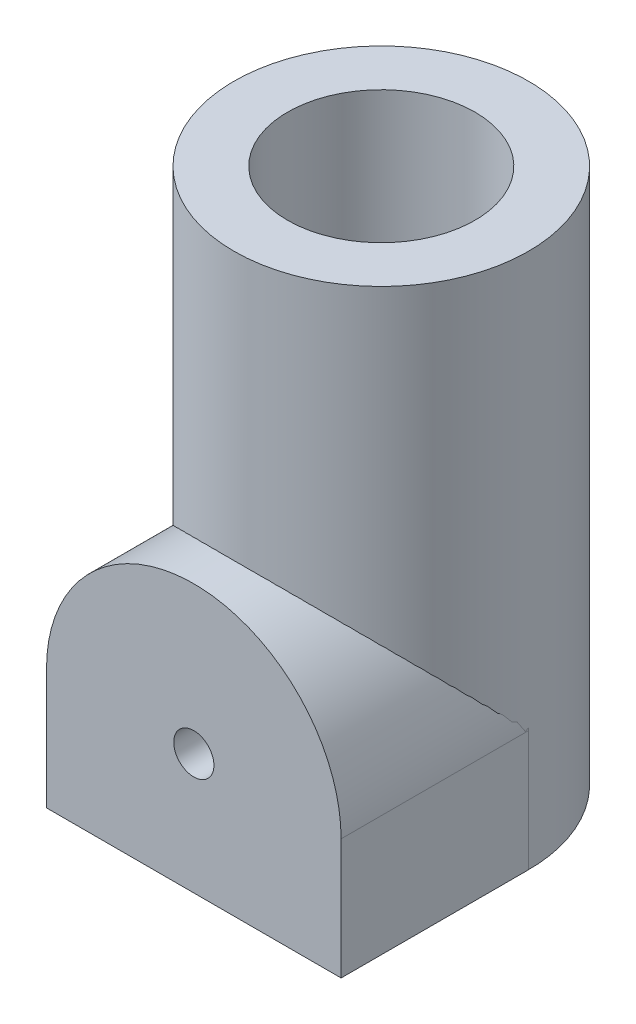
from build123d import *

# Parameters (mm, degrees)
SKETCH1_R           = 5.5
SKETCH1_R_2         = 3.5
BOSS_EXTRUDE1_DEPTH = 20
BOSS_EXTRUDE2_DEPTH = 7
SKETCH3_R           = 0.75
CUT_EXTRUDE1_DEPTH  = 30


with BuildPart() as part:
    # Sketch1 → Boss-Extrude1 (new body)
    with BuildSketch(Plane(origin=(0, 0, 0), x_dir=(1, 0, 0), z_dir=(0, 1, 0))):
        with Locations(Location((0, 0, 0), (0, 0, 270))):
            Circle(SKETCH1_R)
        with Locations(Location((0, 0, 0), (0, 0, 270))):
            Circle(SKETCH1_R_2, mode=Mode.SUBTRACT)
    extrude(amount=BOSS_EXTRUDE1_DEPTH)


with BuildPart() as body_2:
    # Sketch2 → Boss-Extrude2 (new body)
    with BuildSketch(Plane.XY):
        with BuildLine():
            ThreePointArc((0, 10), (-3.8890873, 8.389087293), (-5.5, 4.49999999))
            ThreePointArc((-5.5, 4.49999999), (-4.880703181, 1.964504692), (-3.16227766, 0))
            Line((-3.16227766, 0), (3.16227766, 0))
            ThreePointArc((3.16227766, 0), (4.880703184, 1.964504696), (5.5, 4.5))
            ThreePointArc((5.5, 4.5), (3.889087297, 8.389087297), (0, 10))
        make_face()
        with BuildLine():
            Line((-5.5, 4.49999999), (-5.5, 0))
            Line((-5.5, 0), (-3.16227766, 0))
            ThreePointArc((-3.16227766, 0), (-4.880703181, 1.964504692), (-5.5, 4.49999999))
        make_face()
        with BuildLine():
            Line((3.16227766, 0), (5.5, 0))
            Line((5.5, 0), (5.5, 4.5))
            ThreePointArc((5.5, 4.5), (4.880703184, 1.964504696), (3.16227766, 0))
        make_face()
    extrude(amount=BOSS_EXTRUDE2_DEPTH)


with BuildPart() as cut_extrude1_tool:
    # Sketch3 → Cut-Extrude1 (new body)
    with BuildSketch(Plane.XY.offset(7)):
        with Locations((0, 4.5)):
            Circle(SKETCH3_R)
    extrude(amount=-CUT_EXTRUDE1_DEPTH)


with BuildPart() as part_1:
    add(part.part)

    # Cut-Extrude1: cut by cut_extrude1_tool
    add(cut_extrude1_tool.part, mode=Mode.SUBTRACT)


with BuildPart() as body_2_1:
    add(body_2.part)

    # Cut-Extrude1: cut by cut_extrude1_tool
    add(cut_extrude1_tool.part, mode=Mode.SUBTRACT)


solid = Compound([part_1.part, body_2_1.part])
